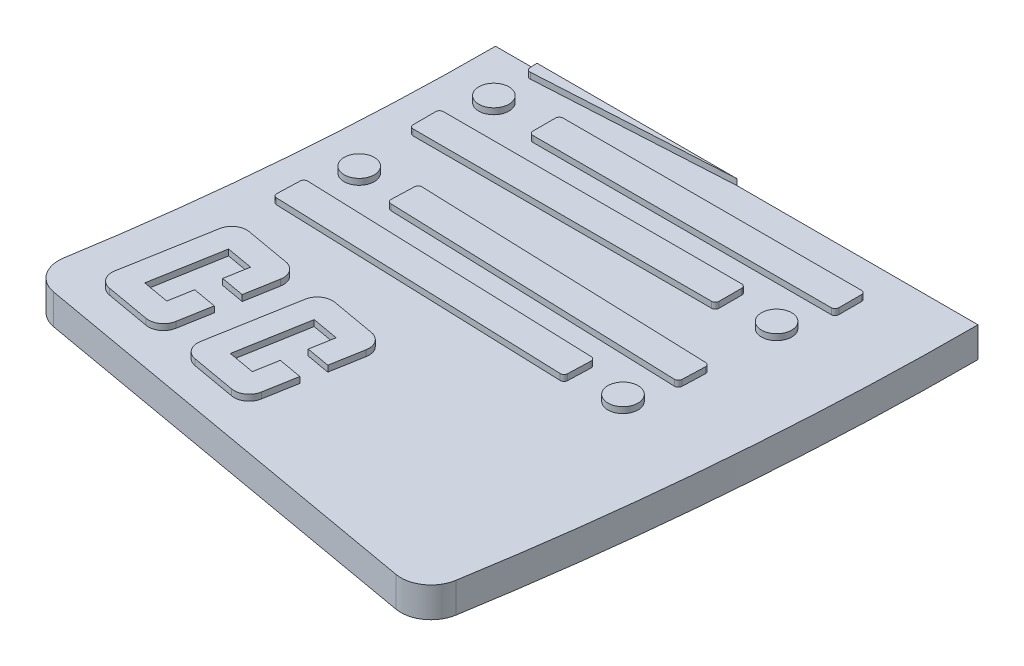
from build123d import *

# Parameters (mm, degrees)
BOSS_EXTRUDE1_DEPTH = 12.7
FILLET1_R           = 12.7
BOSS_EXTRUDE2_DEPTH = 2.54
FILLET2_R           = 6.35
SKETCH3_R           = 6.35
SKETCH3_W           = 128.842678874
SKETCH3_H           = 12.7
BOSS_EXTRUDE3_DEPTH = 2.54
FILLET3_R           = 1.5875


with BuildPart() as part:
    # Sketch1 → Boss-Extrude1 (new body)
    with BuildSketch(Plane(origin=(0, 0, 0), x_dir=(1, 0, 0), z_dir=(0, 1, 0))):
        with BuildLine():
            Line((-101.6, 0), (101.6, 0))
            ThreePointArc((101.6, 0), (96.863119244, -108.334556213), (82.688632431, -215.842221209))
            Line((82.688632431, -215.842221209), (-117.415334702, -180.506087613))
            ThreePointArc((-117.415334702, -180.506087613), (-105.561392761, -90.598803078), (-101.6, 0))
        make_face()
    extrude(amount=BOSS_EXTRUDE1_DEPTH)

    # Fillet1
    fillet1_edges = [part.edges().sort_by_distance(p)[0] for p in [
        (82.688632431, 6.35, 215.842221209),
        (-117.415334702, 6.35, 180.506087613),
    ]]
    fillet(fillet1_edges, radius=FILLET1_R)

    # Sketch2 → Boss-Extrude2 (add)
    with BuildSketch(Plane(origin=(0, 12.7, 0), x_dir=(1, 0, 0), z_dir=(0, 1, 0))):
        Polygon((-54.61463437, -178.699496428), (-23.348389506, -184.220767302), (-19.814776146, -164.210370589), (-29.819974503, -162.443563909), (-31.586781182, -172.448762265), (-42.842629334, -170.461104751), (-37.542209294, -140.445509681), (-26.286361143, -142.433167195), (-28.053167823, -152.438365552), (-18.047969466, -154.205172232), (-14.514356107, -134.194775519), (-45.780600971, -128.673504644), align=None)
        Polygon((-98.387377181, -170.969717203), (-67.121132316, -176.490988078), (-63.587518956, -156.480591364), (-73.592717313, -154.713784685), (-75.359523993, -164.718983041), (-86.615372144, -162.731325527), (-81.314952105, -132.715730457), (-70.059103953, -134.703387971), (-71.825910633, -144.708586328), (-61.820712277, -146.475393008), (-58.287098917, -126.464996294), (-89.553343782, -120.94372542), align=None)
    extrude(amount=BOSS_EXTRUDE2_DEPTH)

    # Fillet2
    fillet2_edges = [part.edges().sort_by_distance(p)[0] for p in [
        (-67.121132316, 13.97, 176.490988078),
        (-58.287098917, 13.97, 126.464996294),
        (-89.553343782, 13.97, 120.94372542),
        (-98.387377181, 13.97, 170.969717203),
        (-23.348389506, 13.97, 184.220767302),
        (-14.514356107, 13.97, 134.194775519),
        (-45.780600971, 13.97, 128.673504644),
        (-54.61463437, 13.97, 178.699496428),
    ]]
    fillet(fillet2_edges, radius=FILLET2_R)

    # Sketch3 → Boss-Extrude3 (add)
    with BuildSketch(Plane(origin=(0, 12.7, 0), x_dir=(1, 0, 0), z_dir=(0, 1, 0))):
        with Locations(Location((-84.061485004, -74.95573952, 0), (0, 0, 90))):
            Circle(SKETCH3_R)
        with Locations(Location((54.755611036, -102.677273515, 0), (0, 0, 90))):
            Circle(SKETCH3_R)
        with Locations(Location((-81.443399967, -20.868490804, 0), (0, 0, 90))):
            Circle(SKETCH3_R)
        with Locations(Location((60.495827673, -43.728490804, 0), (0, 0, 90))):
            Circle(SKETCH3_R)
        Polygon((-65.244701553, -81.966706683), (61.677933479, -86.398942765), (62.121157087, -73.706679262), (-64.801477945, -69.27444318), align=None)
        Polygon((-91.427031054, -103.926333773), (35.495603978, -108.358569854), (35.938827586, -95.666306351), (-90.983807446, -91.23407027), align=None)
        with Locations((4.18018601, -20.868490804)):
            Rectangle(SKETCH3_W, SKETCH3_H)
        with Locations((-23.37206053, -43.728490804)):
            Rectangle(SKETCH3_W, SKETCH3_H)
        Polygon((-84.153810009, 0), (-83.882599151, -4.769682556), (0, 0), align=None)
    extrude(amount=BOSS_EXTRUDE3_DEPTH)

    # Fillet3
    fillet3_edges = [part.edges().sort_by_distance(p)[0] for p in [
        (-64.801477945, 13.97, 69.27444318),
        (-65.244701553, 13.97, 81.966706683),
        (61.677933479, 13.97, 86.398942765),
        (62.121157087, 13.97, 73.706679262),
        (-83.882599151, 13.97, 4.769682556),
        (-90.983807446, 13.97, 91.23407027),
        (-91.427031054, 13.97, 103.926333773),
        (35.495603978, 13.97, 108.358569854),
        (35.938827586, 13.97, 95.666306351),
        (-60.241153427, 13.97, 14.518490804),
        (-60.241153427, 13.97, 27.218490804),
        (68.601525447, 13.97, 27.218490804),
        (68.601525447, 13.97, 14.518490804),
        (-87.793399967, 13.97, 37.378490804),
        (-87.793399967, 13.97, 50.078490804),
        (41.049278907, 13.97, 50.078490804),
        (41.049278907, 13.97, 37.378490804),
    ]]
    fillet(fillet3_edges, radius=FILLET3_R)


solid = part.part
